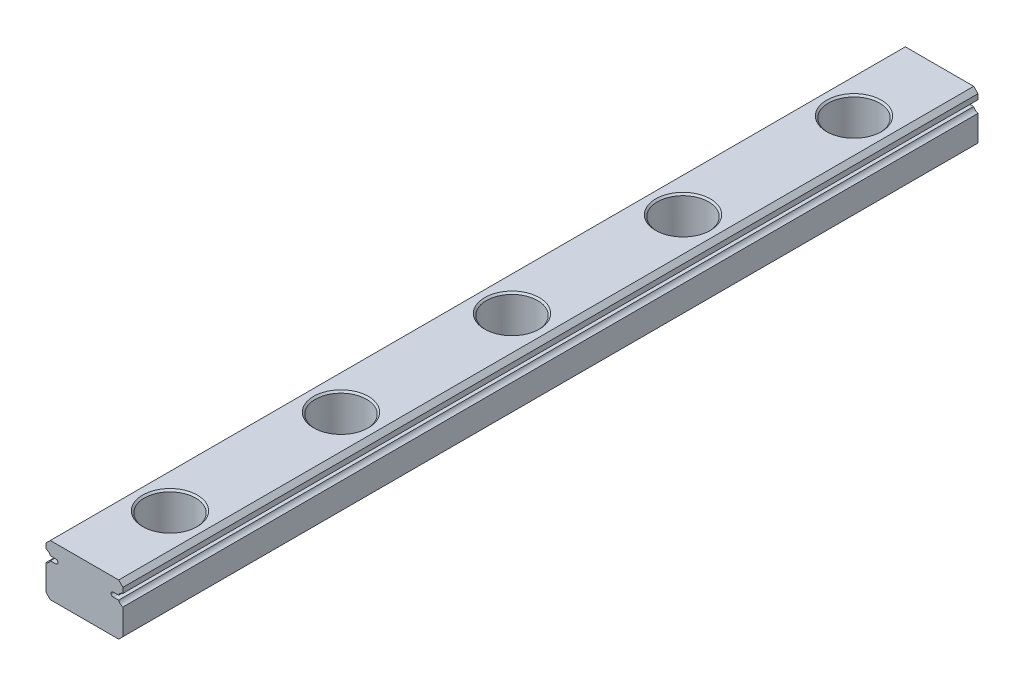
from build123d import *

# Parameters (mm, degrees)
BOSS_EXTRUDE1_DEPTH        = 100
SKETCH2_R                  = 3
CUT_EXTRUDE1_DEPTH         = 4.5
SKETCH3_R                  = 1.75
CUT_EXTRUDE2_DEPTH         = 101.202295383
CHAMFER1_SIZE              = 0.2
LPATTERN1_COUNT            = 5
LPATTERN1_PITCH            = 20
CHAMFER1_OF_LPATTERN1_SIZE = 0.2


with BuildPart() as part:
    # Sketch1 → Boss-Extrude1 (new body)
    with BuildSketch(Plane.XY):
        with BuildLine():
            Line((4.5, -2.5), (4.5, 0.514709157))
            ThreePointArc((4.5, 0.514709157), (4.188868575, 0.667088042), (3.988911299, 0.95))
            Line((3.988911299, 0.95), (3.35, 0.95))
            ThreePointArc((3.35, 0.95), (3.1, 1.2), (3.35, 1.45))
            Line((3.35, 1.45), (3.988911299, 1.45))
            ThreePointArc((3.988911299, 1.45), (4.188868575, 1.732911958), (4.5, 1.885290843))
            Line((4.5, 1.885290843), (4.5, 2.5))
            Line((4.5, 2.5), (4, 3))
            Line((4, 3), (-4, 3))
            Line((-4, 3), (-4.5, 2.5))
            Line((-4.5, 2.5), (-4.5, 1.885290843))
            ThreePointArc((-4.5, 1.885290843), (-4.188868575, 1.732911958), (-3.988911299, 1.45))
            Line((-3.988911299, 1.45), (-3.35, 1.45))
            ThreePointArc((-3.35, 1.45), (-3.1, 1.2), (-3.35, 0.95))
            Line((-3.35, 0.95), (-3.988911299, 0.95))
            ThreePointArc((-3.988911299, 0.95), (-4.188868575, 0.667088042), (-4.5, 0.514709157))
            Line((-4.5, 0.514709157), (-4.5, -2.5))
            Line((-4.5, -2.5), (-4, -3))
            Line((-4, -3), (4, -3))
            Line((4, -3), (4.5, -2.5))
        make_face()
    extrude(amount=BOSS_EXTRUDE1_DEPTH)

    # Sketch2 → Cut-Extrude1 (cut)
    with BuildSketch(Plane(origin=(0, 3, 0), x_dir=(1, 0, 0), z_dir=(0, 1, 0))):
        with Locations(Location((0, -10, 0), (0, 0, 180))):
            Circle(SKETCH2_R)
    cut_extrude1 = extrude(amount=-CUT_EXTRUDE1_DEPTH, mode=Mode.SUBTRACT)

    # Sketch3 → Cut-Extrude2 (cut, through all)
    with BuildSketch(Plane(origin=(0, -1.5, 0), x_dir=(1, 0, 0), z_dir=(0, 1, 0))):
        with Locations(Location((0, -10, 0), (0, 0, 180))):
            Circle(SKETCH3_R)
    cut_extrude2 = extrude(amount=-CUT_EXTRUDE2_DEPTH, mode=Mode.SUBTRACT)

    # Chamfer1
    chamfer1_edges = [part.edges().sort_by_distance(p)[0] for p in [
        (3, 3, 10),
        (1.75, -3, 10),
    ]]
    chamfer(chamfer1_edges, length=CHAMFER1_SIZE)

    # LPattern1: Cut-Extrude1, Cut-Extrude2 ×5
    with Locations(*[(0, 0, i * LPATTERN1_PITCH) for i in range(1, LPATTERN1_COUNT)]):
        add(cut_extrude1, mode=Mode.SUBTRACT)
        add(cut_extrude2, mode=Mode.SUBTRACT)

    # Chamfer1 of LPattern1
    chamfer1_of_lpattern1_edges = [part.edges().sort_by_distance(p)[0] for p in [
        (3, 3, 30),
        (1.75, -3, 30),
        (3, 3, 50),
        (1.75, -3, 50),
        (3, 3, 70),
        (1.75, -3, 70),
        (3, 3, 90),
        (1.75, -3, 90),
    ]]
    chamfer(chamfer1_of_lpattern1_edges, length=CHAMFER1_OF_LPATTERN1_SIZE)


solid = part.part
